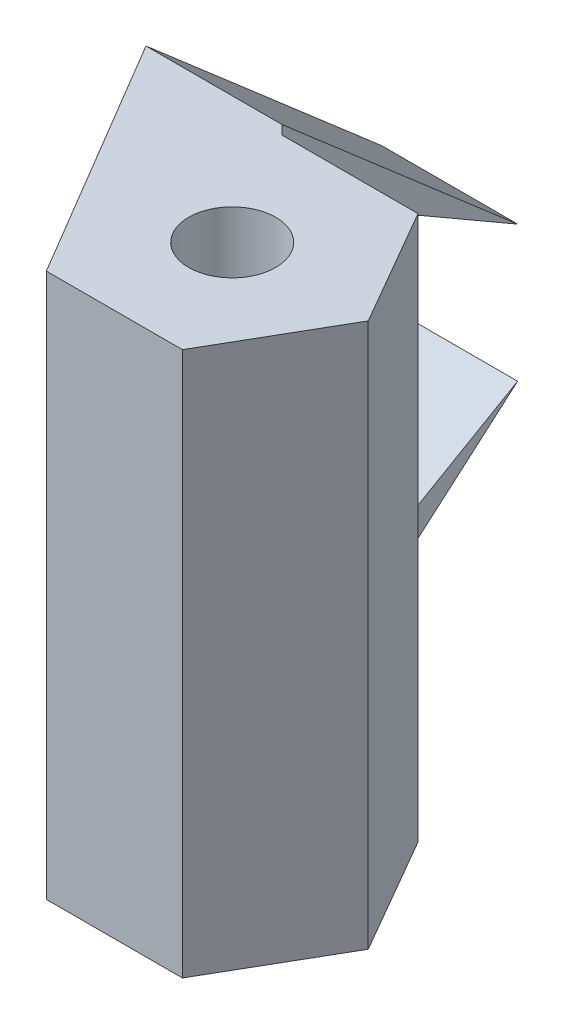
from build123d import *

# Parameters (mm, degrees)
BOSS_EXTRUDE1_DEPTH = 25.4
SKETCH3_R           = 2.032
CUT_EXTRUDE1_DEPTH  = 25.4
BOSS_EXTRUDE2_DEPTH = 25.4
BOSS_EXTRUDE4_DEPTH = 6.35


with BuildPart() as part:
    # Sketch1 → Boss-Extrude1 (new body)
    with BuildSketch(Plane(origin=(0, 0, 0), x_dir=(1, 0, 0), z_dir=(0, 1, 0))):
        Polygon((3.175, 5.499261314), (-3.175, 5.499261314), (-6.35, 0), (-3.175, -5.499261314), (3.175, -5.499261314), (6.35, 0), align=None)
    extrude(amount=BOSS_EXTRUDE1_DEPTH)

    # Sketch3 → Cut-Extrude1 (cut)
    with BuildSketch(Plane(origin=(0, 25.4, 0), x_dir=(1, 0, 0), z_dir=(0, 1, 0))):
        with Locations(Location((0, 0, 0), (0, 0, 270))):
            Circle(SKETCH3_R)
    extrude(amount=-CUT_EXTRUDE1_DEPTH, mode=Mode.SUBTRACT)

    # Sketch2 → Boss-Extrude2 (add)
    with BuildSketch(Plane(origin=(0, 25.4, 0), x_dir=(1, 0, 0), z_dir=(0, 1, 0))):
        Polygon((-3.175, -5.499261314), (-9.950369343, 5.924630657), (-3.600369343, 5.924630657), (-3.175, 5.499261314), (-6.35, 0), align=None)
    extrude(amount=-BOSS_EXTRUDE2_DEPTH)

    # Sketch5 → Boss-Extrude4 (add)
    with BuildSketch(Plane.ZY.offset(9.950369343)):
        Polygon((-5.924630657, 15.875), (-11.423891971, 19.05), (-16.923153285, 15.875), (-5.924630657, 25.4), align=None)
        Polygon((-16.923153285, 9.525), (-5.924630657, 0), (-5.924630657, 9.525), (-11.423891971, 6.35), align=None)
    extrude(amount=-BOSS_EXTRUDE4_DEPTH)


solid = part.part
